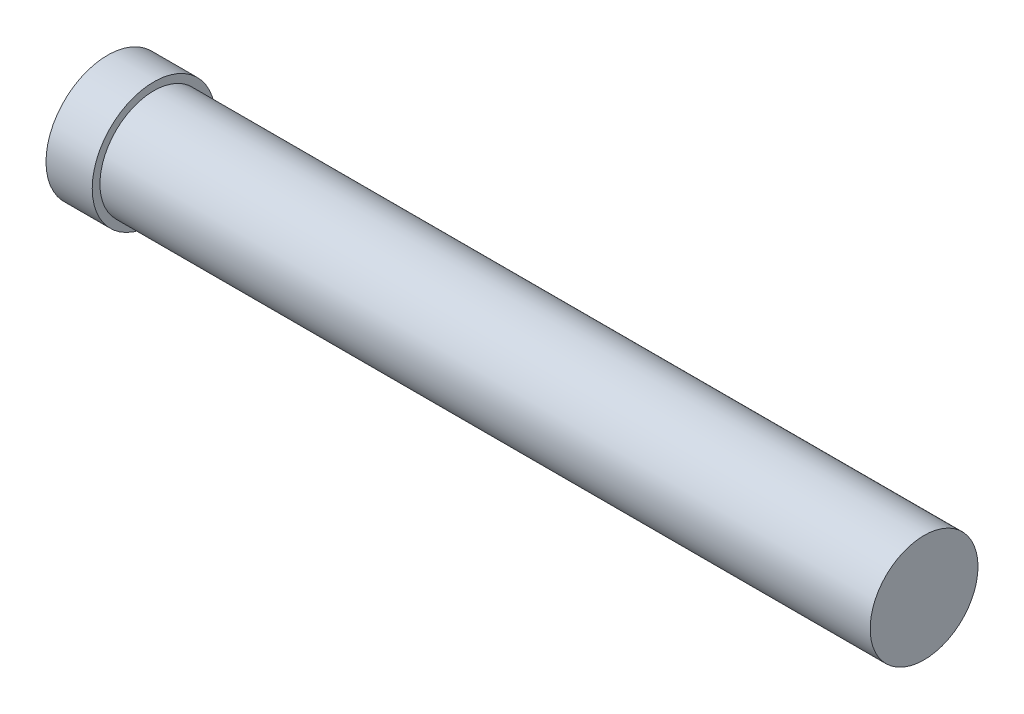
from build123d import *

# Parameters (mm, degrees)
SKETCH1_R           = 3.5
BOSS_EXTRUDE1_DEPTH = 50
SKETCH2_R           = 4
BOSS_EXTRUDE2_DEPTH = 3


with BuildPart() as part:
    # Sketch1 → Boss-Extrude1 (new body)
    with BuildSketch(Plane(origin=(0, 0, 0), x_dir=(0, 0, -1), z_dir=(1, 0, 0))):
        Circle(SKETCH1_R)
    extrude(amount=BOSS_EXTRUDE1_DEPTH)

    # Sketch2 → Boss-Extrude2 (add)
    with BuildSketch(Plane.ZY):
        Circle(SKETCH2_R)
    extrude(amount=BOSS_EXTRUDE2_DEPTH)


solid = part.part
